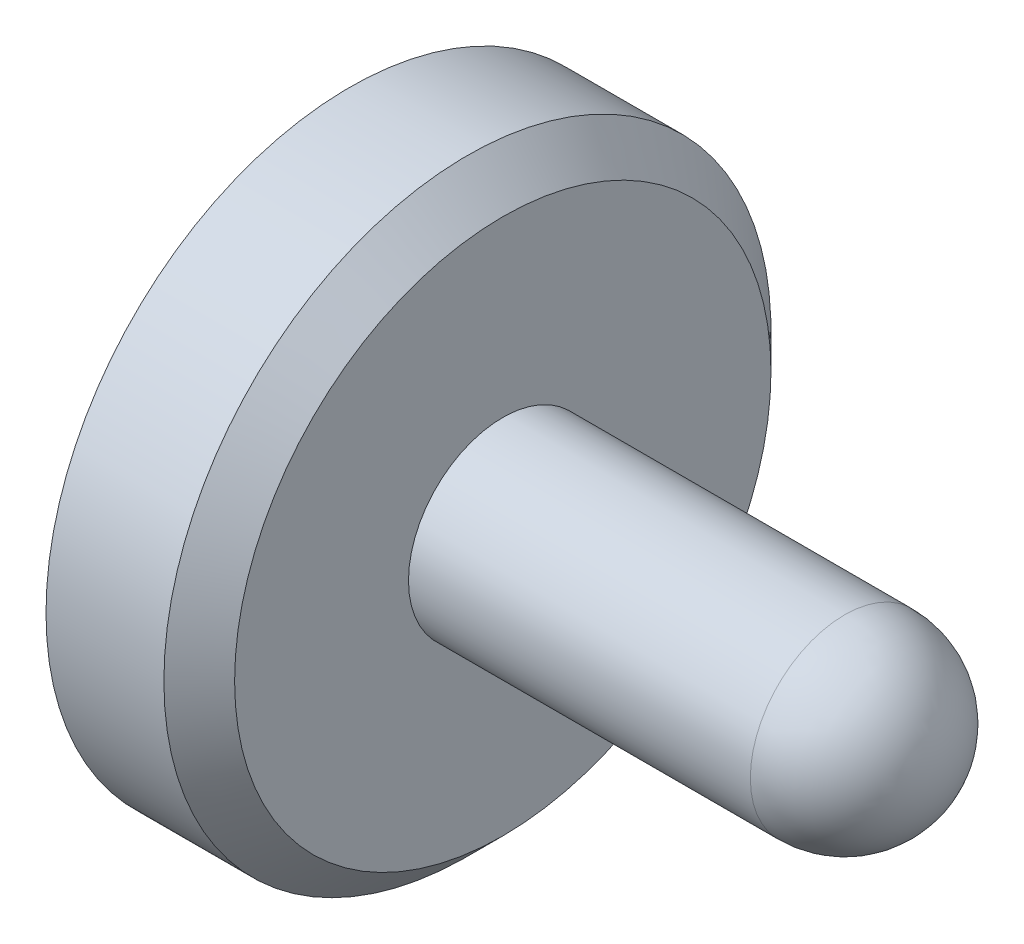
from build123d import *


with BuildPart() as part:
    # Sketch1 → RevolutionAngle1 (revolve)
    with BuildSketch(Plane.XY, mode=Mode.PRIVATE) as revolutionangle1_sk:
        with BuildLine():
            Line((0, 0), (0, 0.65405))
            Line((0, 0.65405), (0.254, 0.65405))
            Line((0.254, 0.65405), (0.3302, 0.57785))
            Line((0.3302, 0.57785), (0.3302, 0.2032))
            Line((0.3302, 0.2032), (1.0668, 0.2032))
            ThreePointArc((1.0668, 0.2032), (1.210484098, 0.143684098), (1.27, 0))
            Line((1.27, 0), (0, 0))
        make_face()
    revolve(revolutionangle1_sk.sketch.rotate(Axis((0, 0, 0), (1, 0, 0)), 90), axis=Axis((0, 0, 0), (1, 0, 0)))


solid = part.part
